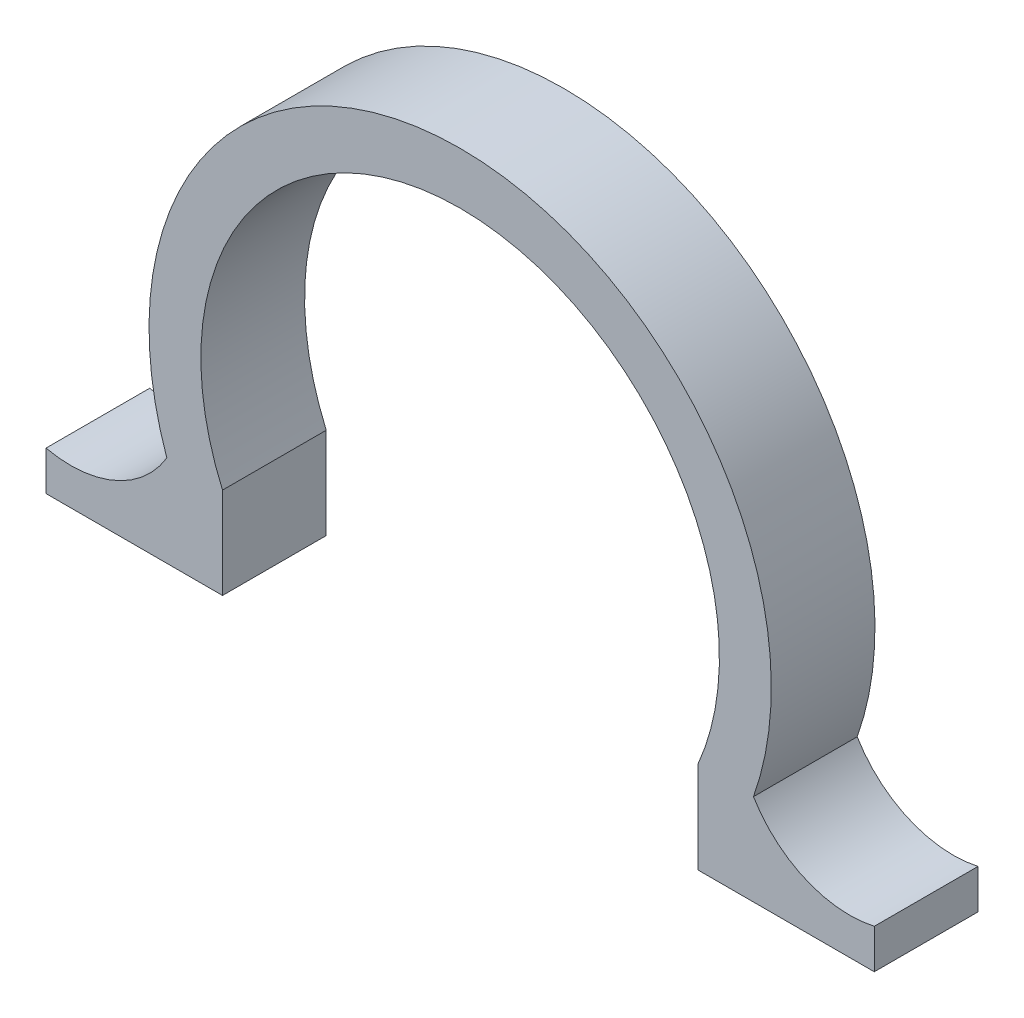
from build123d import *

# Parameters (mm, degrees)
BOSS_EXTRUDE2_DEPTH = 12.7
BOSS_EXTRUDE3_DEPTH = 12.7


with BuildPart() as part:
    # Sketch3 → Boss-Extrude2 (new body)
    with BuildSketch(Plane.XY):
        with BuildLine():
            Line((-35.921024484, -12.7), (-29.099355663, -12.7))
            ThreePointArc((-29.099355663, -12.7), (0, 31.75), (29.099355663, -12.7))
            Line((29.099355663, -12.7), (35.921024484, -12.7))
            ThreePointArc((35.921024484, -12.7), (0, 38.1), (-35.921024484, -12.7))
        make_face()
    extrude(amount=BOSS_EXTRUDE2_DEPTH)

    # Sketch4 → Boss-Extrude3 (add)
    with BuildSketch(Plane(origin=(0, 0, 0), x_dir=(-1, 0, 0), z_dir=(0, 0, -1))):
        with BuildLine():
            Line((-29.099355663, -12.7), (-29.099355663, -23.876))
            Line((-29.099355663, -23.876), (-50.714755663, -23.876))
            Line((-50.714755663, -23.876), (-50.714755663, -19.05))
            ThreePointArc((-50.714755663, -19.05), (-42.288257842, -18.27375629), (-35.921024484, -12.7))
            Line((-35.921024484, -12.7), (-29.099355663, -12.7))
        make_face()
        with BuildLine():
            Line((29.099355663, -12.7), (29.099355663, -23.876))
            Line((29.099355663, -23.876), (50.714755663, -23.876))
            Line((50.714755663, -23.876), (50.714755663, -19.05))
            ThreePointArc((50.714755663, -19.05), (42.288257842, -18.27375629), (35.921024484, -12.7))
            Line((35.921024484, -12.7), (29.099355663, -12.7))
        make_face()
    extrude(amount=-BOSS_EXTRUDE3_DEPTH)


solid = part.part
